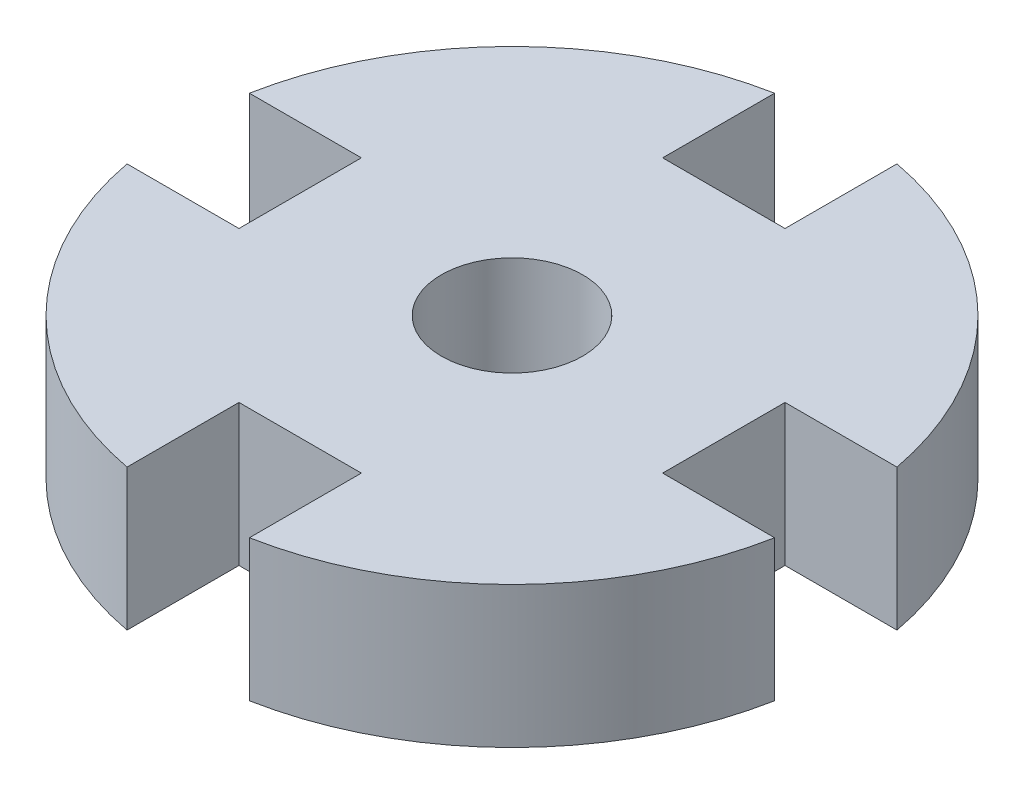
from build123d import *

# Parameters (mm, degrees)
BOSS_EXTRUDE1_DEPTH      = 1.5
BOSS_EXTRUDE1_DEPTH_BACK = 1.5
SKETCH1_R                = 7
SKETCH1_R_2              = 1.5
SKETCH2_W                = 5
SKETCH2_H                = 2.6
CUT_EXTRUDE1_DEPTH       = 11.344080433
CIRPATTERN1_COUNT        = 4


with BuildPart() as part:
    # Sketch1 → Boss-Extrude1 (new, two sides: drawn at the far end of the back side and taken through both)
    with BuildSketch(Plane(origin=(0, 0, 0), x_dir=(1, 0, 0), z_dir=(0, 1, 0)).offset(-BOSS_EXTRUDE1_DEPTH_BACK)):
        Circle(SKETCH1_R)
        Circle(SKETCH1_R_2, mode=Mode.SUBTRACT)
    extrude(amount=BOSS_EXTRUDE1_DEPTH + BOSS_EXTRUDE1_DEPTH_BACK)

    # Sketch2 → Cut-Extrude1 (cut, through all)
    with BuildSketch(Plane(origin=(0, 1.5, 0), x_dir=(1, 0, 0), z_dir=(0, 1, 0))):
        with Locations((7, 0)):
            Rectangle(SKETCH2_W, SKETCH2_H)
    cut_extrude1 = extrude(amount=-CUT_EXTRUDE1_DEPTH, mode=Mode.SUBTRACT)

    # CirPattern1: Cut-Extrude1 ×4 about axis
    cirpattern1_axis = Axis((0, -1.5, 0), (0, 1, 0))
    for i in range(1, CIRPATTERN1_COUNT):
        add(cut_extrude1.rotate(cirpattern1_axis, i * 360 / CIRPATTERN1_COUNT), mode=Mode.SUBTRACT)


solid = part.part
